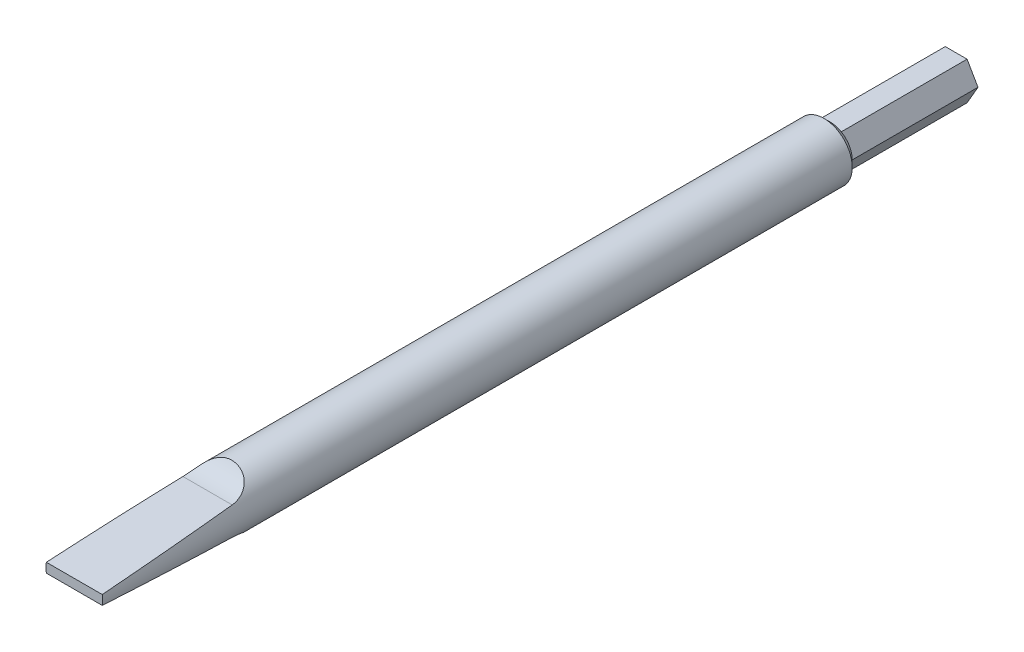
from build123d import *

# Parameters (mm, degrees)
BOSS_EXTRUDE1_DEPTH     = 20
SKETCH1_3_R             = 4.5
BOSS_EXTRUDE2_DEPTH     = 120
CHAMFER1_SIZE           = 1
CUT_EXTRUDE3_DEPTH      = 120
CUT_EXTRUDE3_DEPTH_BACK = 120


with BuildPart() as part:
    # Sketch1 → Boss-Extrude1 (new body)
    with BuildSketch(Plane.XY):
        Polygon((3.464101615, 0), (1.732050808, 3), (-1.732050808, 3), (-3.464101615, 0), (-1.732050808, -3), (1.732050808, -3), align=None)
    extrude(amount=-BOSS_EXTRUDE1_DEPTH)

    # Sketch1<3> → Boss-Extrude2 (add)
    with BuildSketch(Plane.XY):
        Circle(SKETCH1_3_R)
    extrude(amount=BOSS_EXTRUDE2_DEPTH)

    # Chamfer1
    chamfer1_edges = [part.edges().sort_by_distance(p)[0] for p in [
        (-4.5, 0, 0),
    ]]
    chamfer(chamfer1_edges, length=CHAMFER1_SIZE)

    # Sketch2 → Cut-Extrude3 (cut, two sides: drawn at the far end of the back side and taken through both)
    with BuildSketch(Plane(origin=(0, 0, 0), x_dir=(0, 0, -1), z_dir=(1, 0, 0)).offset(-CUT_EXTRUDE3_DEPTH_BACK)):
        with BuildLine():
            Line((-120, -0.75), (-120, -4.5))
            Line((-120, -4.5), (-95, -4.5))
            ThreePointArc((-95, -4.5), (-96.656515683, -2.910634909), (-98.848674543, -2.229044758))
            Line((-98.848674543, -2.229044758), (-120, -0.75))
        make_face()
        with BuildLine():
            Line((-120, 0.75), (-98.848674543, 2.229044758))
            ThreePointArc((-98.848674543, 2.229044758), (-96.656515683, 2.910634909), (-95, 4.5))
            Line((-95, 4.5), (-120, 4.5))
            Line((-120, 4.5), (-120, 0.75))
        make_face()
    extrude(amount=CUT_EXTRUDE3_DEPTH + CUT_EXTRUDE3_DEPTH_BACK, mode=Mode.SUBTRACT)


solid = part.part
